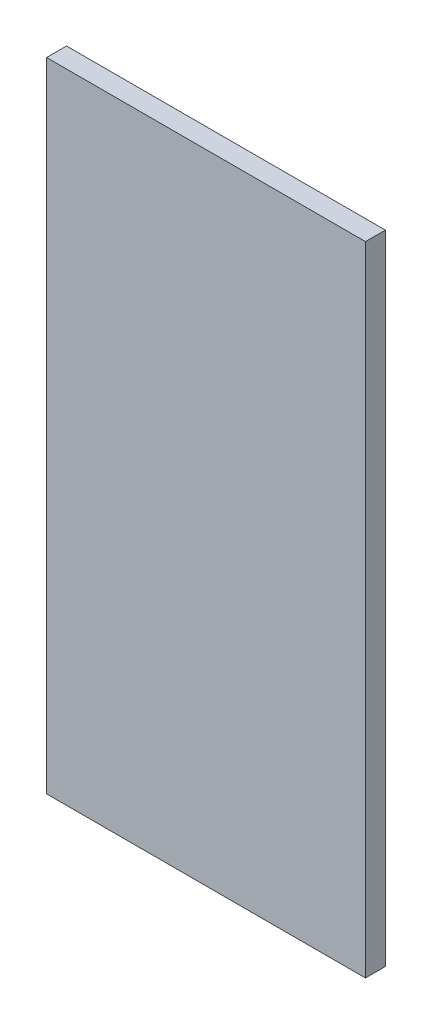
from build123d import *

# Parameters (mm, degrees)
SKETCH1_W           = 25.4
SKETCH1_H           = 50.8
BOSS_EXTRUDE1_DEPTH = 1.5875


with BuildPart() as part:
    # Sketch1 → Boss-Extrude1 (new body)
    with BuildSketch(Plane.XY):
        Rectangle(SKETCH1_W, SKETCH1_H)
    extrude(amount=BOSS_EXTRUDE1_DEPTH)


solid = part.part
